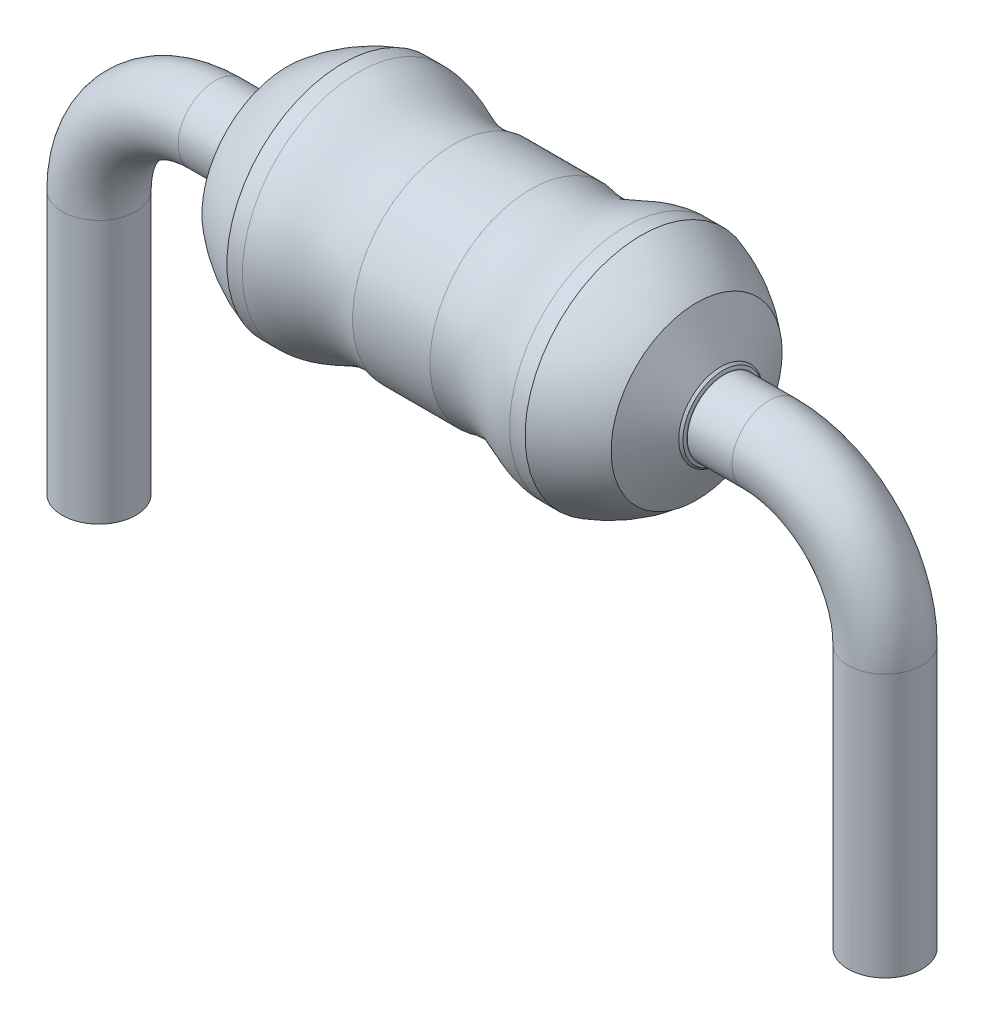
from build123d import *

# Parameters (mm, degrees)
FILLET_2_R = 0.01
CROQUIS5_R = 0.238353461


with BuildPart() as part:
    # Croquis1 → Revolución1 (revolve)
    with BuildSketch(Plane.XY, mode=Mode.PRIVATE) as revoluci_n1_sk:
        with BuildLine():
            Line((1.5, 0.240314053), (1.5, 0))
            Line((1.5, 0), (-1.5, 0))
            Line((-1.5, 0), (-1.5, 0.240314053))
            Line((-1.5, 0.240314053), (-1.492530704, 0.25863042))
            ThreePointArc((-1.492530704, 0.25863042), (-1.484958173, 0.264809016), (-1.477516569, 0.271144691))
            Line((-1.477516569, 0.271144691), (-1.322332385, 0.55272587))
            ThreePointArc((-1.322332385, 0.55272587), (-1.1525499, 0.668992005), (-0.963389621, 0.75))
            Line((-0.963389621, 0.75), (-0.863389621, 0.75))
            add(Edge.make_bspline(
                [(-0.863389621, 0.75), (-0.629755248, 0.75353904), (-0.540627107, 0.576942291), (-0.25, 0.651526231)],
                knots=[0.1414219, 0.1414219, 0.1414219, 0.1414219, 1, 1, 1, 1], degree=3))
            Line((-0.25, 0.651526231), (0.25, 0.651526231))
            add(Edge.make_bspline(
                [(0.863389621, 0.75), (0.629755248, 0.75353904), (0.540627107, 0.576942291), (0.25, 0.651526231)],
                knots=[0.1414219, 0.1414219, 0.1414219, 0.1414219, 1, 1, 1, 1], degree=3))
            Line((0.863389621, 0.75), (0.963389621, 0.75))
            ThreePointArc((0.963389621, 0.75), (1.1525499, 0.668992005), (1.322332385, 0.55272587))
            Line((1.322332385, 0.55272587), (1.477516569, 0.271144691))
            ThreePointArc((1.477516569, 0.271144691), (1.484958173, 0.264809016), (1.492530704, 0.25863042))
            Line((1.492530704, 0.25863042), (1.5, 0.240314053))
        make_face()
    revolve(revoluci_n1_sk.sketch.rotate(Axis((26.529158448, 0, 0), (-1, 0, 0)), 90), axis=Axis((26.529158448, 0, 0), (-1, 0, 0)))

    # Скругление2
    fillet_2_edges = [part.edges().sort_by_distance(p)[0] for p in [
        (1.5, 0, 0.240314053),
        (-1.5, 0, 0.240314053),
    ]]
    fillet(fillet_2_edges, radius=FILLET_2_R)

    # Barrer1: sweep along a path in Croquis6
    with BuildLine(Plane.XY) as barrer1_path:
        Line((1.5, 0), (1.79, 0))
        ThreePointArc((1.79, 0), (2.320330086, -0.219669914), (2.54, -0.75))
        Line((2.54, -0.75), (2.54, -2.45))
    # Croquis5 → Barrer1 (sweep)
    with BuildSketch(Plane(origin=(1.5, 0, 0), x_dir=(0, 0, -1), z_dir=(1, 0, 0))):
        Circle(CROQUIS5_R)
    barrer1 = sweep(path=barrer1_path.line)

    # Simetría1: Barrer1 across plane
    add(barrer1.mirror(Plane(origin=(0, 0, 0), x_dir=(0, 0, 1), z_dir=(1, 0, 0))))


solid = part.part
